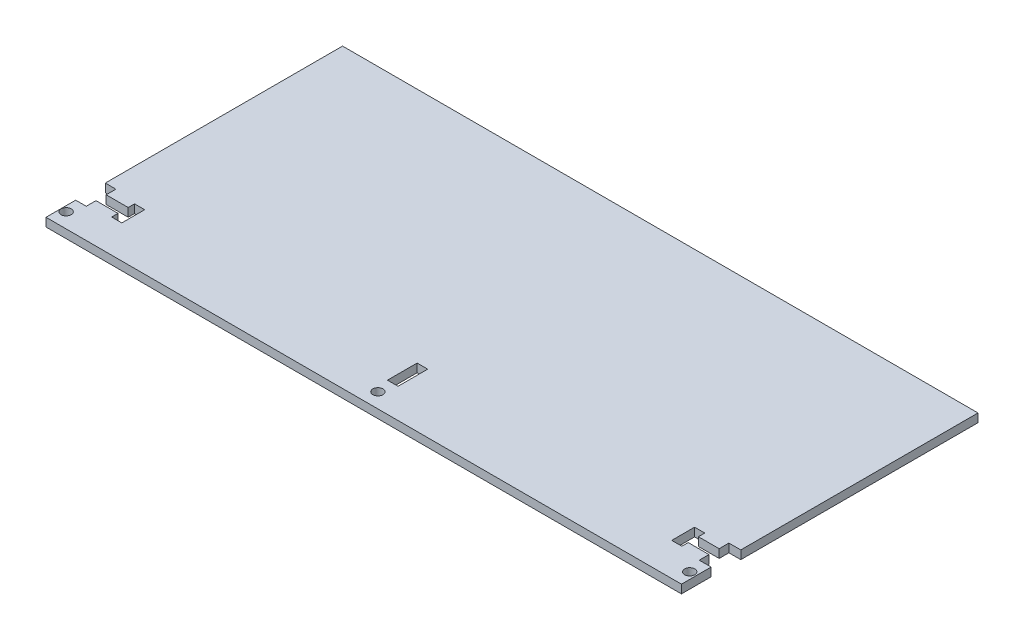
from build123d import *

# Parameters (mm, degrees)
SKETCH1_W           = 3.175
SKETCH1_H           = 8.89
SKETCH1_R           = 1.524
BOSS_EXTRUDE1_DEPTH = 2.54


with BuildPart() as part:
    # Sketch1 → Boss-Extrude1 (new body)
    with BuildSketch(Plane(origin=(0, 0, 0), x_dir=(1, 0, 0), z_dir=(0, 1, 0))):
        Polygon((186.944, -80.01), (186.944, -77.089), (180.721, -77.089), (180.721, -78.994), (177.673, -78.994), (177.673, -72.136), (180.721, -72.136), (180.721, -74.041), (186.944, -74.041), (186.944, -71.12), (190.5, -71.12), (190.5, 0), (0, 0), (0, -71.12), (3.175, -71.12), (3.175, -74.041), (9.779, -74.041), (9.779, -72.136), (12.827, -72.136), (12.827, -78.994), (9.779, -78.994), (9.779, -77.089), (3.175, -77.089), (3.175, -80.01), (0, -80.01), (0, -88.9), (190.5, -88.9), (190.5, -80.01), align=None)
        with Locations((95.0595, -75.565)):
            Rectangle(SKETCH1_W, SKETCH1_H, mode=Mode.SUBTRACT)
        with Locations(Location((95.0595, -84.455, 0), (0, 0, 270))):
            Circle(SKETCH1_R, mode=Mode.SUBTRACT)
        with Locations(Location((1.5875, -84.455, 0), (0, 0, 270))):
            Circle(SKETCH1_R, mode=Mode.SUBTRACT)
        with Locations(Location((188.5315, -84.455, 0), (0, 0, 270))):
            Circle(SKETCH1_R, mode=Mode.SUBTRACT)
    extrude(amount=BOSS_EXTRUDE1_DEPTH)


solid = part.part
